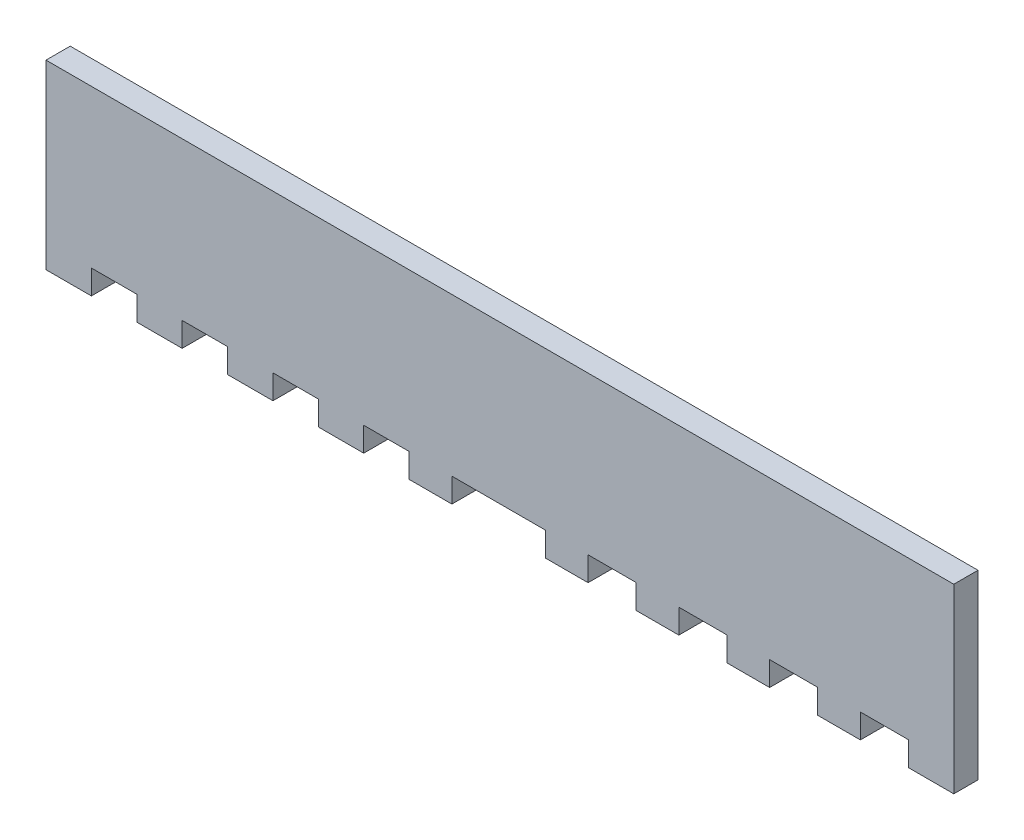
from build123d import *

# Parameters (mm, degrees)
ESQUISSE1_W             = 300
ESQUISSE1_H             = 60
BOSS_EXTRU_1_DEPTH      = 8
ESQUISSE2_W             = 15.862965147
ESQUISSE2_H             = 8
ESQUISSE2_W_2           = 15
ENL_V_MAT_EXTRU_1_DEPTH = 8


with BuildPart() as part:
    # Esquisse1 → Boss.-Extru.1 (new body)
    with BuildSketch(Plane.XY):
        Rectangle(ESQUISSE1_W, ESQUISSE1_H)
    extrude(amount=BOSS_EXTRU_1_DEPTH)

    # Esquisse2 → Enlèv. mat.-Extru.1 (cut)
    with BuildSketch(Plane.XY):
        Polygon((-0.862965147, -30), (15, -30), (15, -22), (-0.862965147, -22), (-15.862965147, -22), (-15.862965147, -30), align=None)
        with Locations((37.068517427, -26)):
            Rectangle(ESQUISSE2_W, ESQUISSE2_H)
        with Locations((67.068517426, -26)):
            Rectangle(ESQUISSE2_W, ESQUISSE2_H)
        with Locations((97.068517426, -26)):
            Rectangle(ESQUISSE2_W, ESQUISSE2_H)
        with Locations((127.068517426, -26)):
            Rectangle(ESQUISSE2_W, ESQUISSE2_H)
        with Locations((-127.5, -26)):
            Rectangle(ESQUISSE2_W_2, ESQUISSE2_H)
        with Locations((-97.5, -26)):
            Rectangle(ESQUISSE2_W_2, ESQUISSE2_H)
        with Locations((-67.5, -26)):
            Rectangle(ESQUISSE2_W_2, ESQUISSE2_H)
        with Locations((-37.5, -26)):
            Rectangle(ESQUISSE2_W_2, ESQUISSE2_H)
    extrude(amount=ENL_V_MAT_EXTRU_1_DEPTH, mode=Mode.SUBTRACT)


solid = part.part
